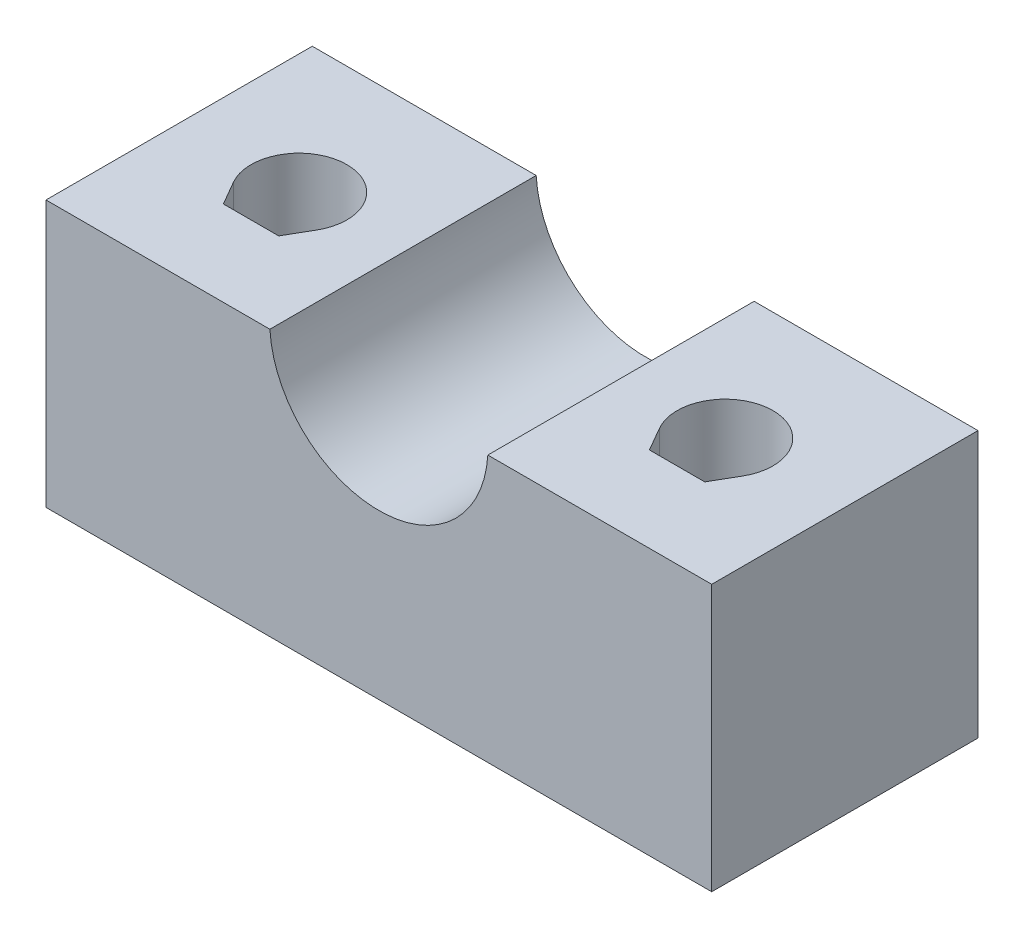
from build123d import *

# Parameters (mm, degrees)
MAIN_BODY_DEPTH   = 5
SCREW_HOLES_REACH = 18.771


with BuildPart() as part:
    # Schizzo1 → Main body (new, symmetric)
    with BuildSketch(Plane.XY):
        with BuildLine():
            Line((-12.5, -5), (12.5, -5))
            Line((12.5, -5), (12.5, 5))
            Line((12.5, 5), (4.092370951, 5))
            ThreePointArc((4.092370951, 5), (0, 1.15), (-4.092370951, 5))
            Line((-4.092370951, 5), (-12.5, 5))
            Line((-12.5, 5), (-12.5, -5))
        make_face()
    extrude(amount=MAIN_BODY_DEPTH, both=True)

    # Schizzo2 → screw holes (cut, up to next)
    with BuildSketch(Plane.XZ.offset(5), mode=Mode.PRIVATE) as screw_holes_sk1:
        with BuildLine():
            Line((-6.960769515, 1.8), (-6.441154273, 0.9))
            ThreePointArc((-6.441154273, 0.9), (-8, -1.8), (-9.558845727, 0.9))
            Line((-9.558845727, 0.9), (-9.039230485, 1.8))
            Line((-9.039230485, 1.8), (-6.960769515, 1.8))
        make_face()
    screw_holes_tool1 = extrude(screw_holes_sk1.sketch, amount=-SCREW_HOLES_REACH, mode=Mode.PRIVATE) & part.part
    # Schizzo2 → screw holes (cut, up to next)
    with BuildSketch(Plane.XZ.offset(5), mode=Mode.PRIVATE) as screw_holes_sk2:
        with BuildLine():
            Line((6.960769515, 1.8), (9.039230485, 1.8))
            Line((9.039230485, 1.8), (9.558845727, 0.9))
            ThreePointArc((9.558845727, 0.9), (8, -1.8), (6.441154273, 0.9))
            Line((6.441154273, 0.9), (6.960769515, 1.8))
        make_face()
    screw_holes_tool2 = extrude(screw_holes_sk2.sketch, amount=-SCREW_HOLES_REACH, mode=Mode.PRIVATE) & part.part
    add(screw_holes_tool1.solids().sort_by_distance((-8, -5, 0.053309))[0], mode=Mode.SUBTRACT)
    add(screw_holes_tool2.solids().sort_by_distance((8, -5, 0.053309))[0], mode=Mode.SUBTRACT)


solid = part.part
